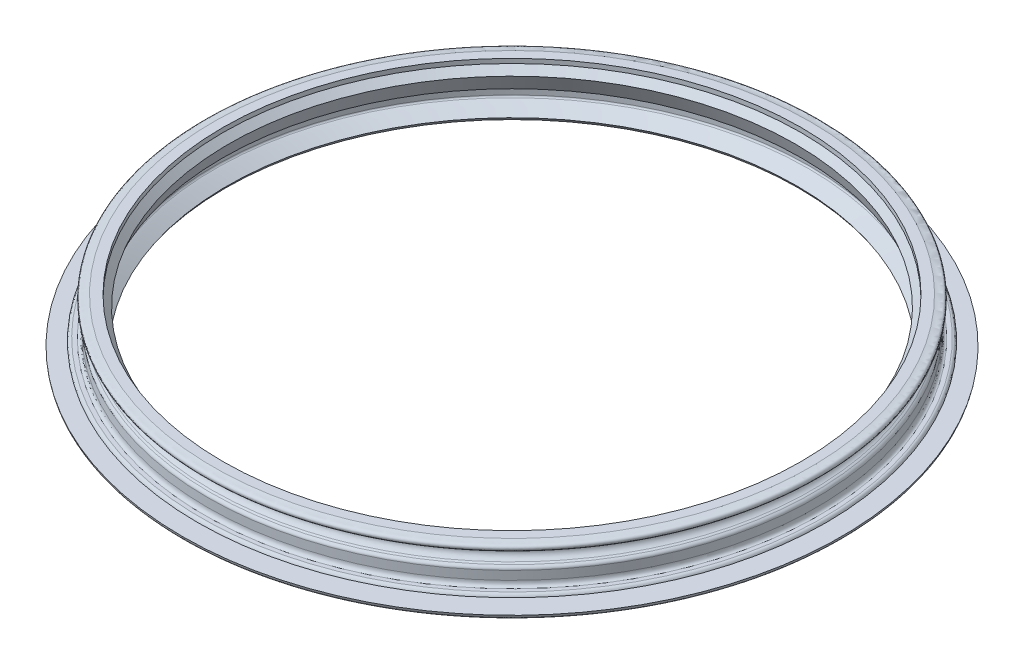
from build123d import *


with BuildPart() as part:
    # Model → Revolução7 (revolve)
    with BuildSketch(Plane.XY):
        with BuildLine():
            add(Edge.make_bspline(
                [(3746.864909456, 4.510725468), (3747.94277404, 4.510725468), (3752.492687234, 4.510725468)],
                knots=[21, 21, 21, 22, 22, 22], degree=2))
            Line((3746.864909456, 4.510725468), (3746.864909456, 5.488503246))
            add(Edge.make_bspline(
                [(3749.128428847, 5.510725468), (3747.860694802, 5.498279421), (3746.864909456, 5.488503246)],
                knots=[19, 19, 19, 20, 20, 20], degree=2))
            add(Edge.make_bspline(
                [(3748.45924482, 6.13294769), (3748.815711834, 6.13294769), (3749.01597225, 5.821836579), (3749.128428847, 5.510725468)],
                knots=[18, 18, 18, 18, 19, 19, 19, 19], degree=3))
            add(Edge.make_bspline(
                [(3747.581467042, 6.13294769), (3747.592578153, 6.13294769), (3748.45924482, 6.13294769)],
                knots=[17, 17, 17, 18, 18, 18], degree=2))
            add(Edge.make_bspline(
                [(3746.864800375, 7.23294769), (3746.864800375, 6.210725468), (3747.581467042, 6.13294769)],
                knots=[16, 16, 16, 17, 17, 17], degree=2))
            add(Edge.make_bspline(
                [(3746.864800375, 9.144058801), (3746.864800375, 8.255169912), (3746.864800375, 7.23294769)],
                knots=[15, 15, 15, 16, 16, 16], degree=2))
            add(Edge.make_bspline(
                [(3746.360156278, 9.910812273), (3746.89722225, 9.581211579), (3746.864800375, 9.144058801)],
                knots=[14, 14, 14, 15, 15, 15], degree=2))
            ThreePointArc((3746.360156278, 9.910812273), (3746.156897379, 10.032628419), (3745.943533014, 10.135725468))
            add(Edge.make_bspline(
                [(3746.963541695, 13.058034496), (3746.837977459, 13.090846996), (3746.706206625, 13.107730676), (3746.570355931, 13.107730676), (3745.713324681, 13.107730676), (3745.018489611, 12.412548384), (3745.018489611, 11.55560394), (3745.018489611, 10.921619565), (3745.398741347, 10.376524079), (3745.943533014, 10.135725468)],
                knots=[10, 10, 10, 10, 11, 11, 11, 12, 12, 12, 13, 13, 13, 13], degree=3))
            add(Edge.make_bspline(
                [(3745.674045167, 14.444058801), (3746.237022597, 14.310725468), (3746.599956625, 14.271836579), (3746.922178847, 14.271836579), (3747.34440107, 14.271836579), (3747.514800375, 13.913546648), (3747.514800375, 13.730169912), (3747.514800375, 13.144796648), (3747.076779542, 13.067800121), (3746.963541695, 13.058034496)],
                knots=[7, 7, 7, 7, 8, 8, 8, 9, 9, 9, 10, 10, 10, 10], degree=3))
            Line((3745.674045167, 14.444058801), (3743.556576123, 14.444058801))
            Line((3743.556576123, 14.444058801), (3743.556576123, 13.455169912))
            Line((3743.556576123, 13.455169912), (3742.214909456, 11.971836579))
            Line((3742.214909456, 11.971836579), (3743.606576123, 8.577392134))
            Line((3743.606576123, 8.577392134), (3744.717687234, 8.577392134))
            add(Edge.make_bspline(
                [(3745.467687234, 7.410725468), (3745.467687234, 7.736636926), (3744.717687234, 8.577392134)],
                knots=[1, 1, 1, 2, 2, 2], degree=2))
            add(Edge.make_bspline(
                [(3745.467687234, 6.077392134), (3745.467687234, 7.084814009), (3745.467687234, 7.410725468)],
                knots=[0, 0, 0, 1, 1, 1], degree=2))
            add(Edge.make_bspline(
                [(3745.233442443, 5.692886926), (3745.485308762, 5.841020607), (3745.467687234, 6.077392134)],
                knots=[30, 30, 30, 31, 31, 31], degree=2))
            add(Edge.make_bspline(
                [(3742.562131679, 3.756558801), (3744.981576123, 5.544753246), (3745.233442443, 5.692886926)],
                knots=[29, 29, 29, 30, 30, 30], degree=2))
            Line((3742.562131679, 3.756558801), (3743.006576123, 3.080169912))
            Line((3743.006576123, 3.080169912), (3744.651020568, 3.916281023))
            add(Edge.make_bspline(
                [(3745.901020568, 3.688503246), (3745.27324279, 4.310725468), (3744.651020568, 3.916281023)],
                knots=[26, 26, 26, 27, 27, 27], degree=2))
            Line((3745.901020568, 3.688503246), (3751.788997998, 3.666281023))
            add(Edge.make_bspline(
                [(3752.492687234, 4.510725468), (3752.374197651, 3.666281023), (3751.788997998, 3.666281023)],
                knots=[0, 0, 0, 1, 1, 1], degree=2))
        make_face()
    revolve(axis=Axis((3679.464909456, -23.097134083, 0), (0, 1, 0)))


solid = part.part
